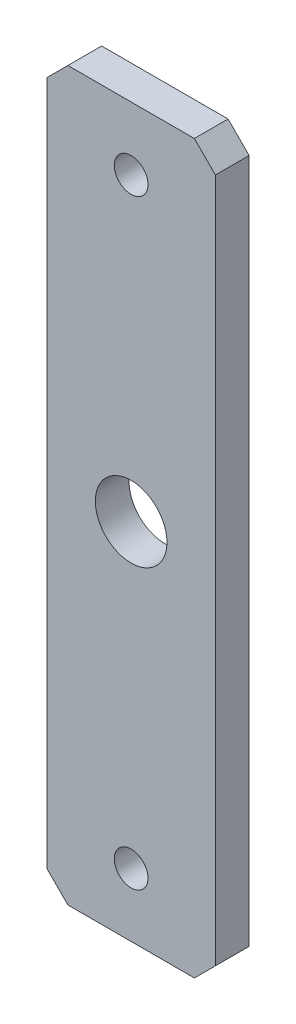
from build123d import *

# Parameters (mm, degrees)
SKETCH_1_W                  = 80
SKETCH_1_H                  = 345
EXTRUDE_1_DEPTH             = 16
HOLE_WIZARD_16_0_16_1_D     = 16
HOLE_WIZARD_16_0_16_1_DEPTH = 38
HOLE_WIZARD_16_0_16_1_TIP   = 4.806884952
CHAMFER_1_SIZE              = 10
HOLE_WIZARD_16_0_16_2_D     = 34


with BuildPart() as part:
    # 草图1 → 凸台-拉伸1 (new body)
    with BuildSketch(Plane.XY):
        with Locations((40, 172.5)):
            Rectangle(SKETCH_1_W, SKETCH_1_H)
    extrude(amount=EXTRUDE_1_DEPTH)

    # Ø16.0 (16) 直径孔1
    with Locations(Plane.XY.offset(16)):
        with Locations((40, 315), (40, 30)):
            Hole(HOLE_WIZARD_16_0_16_1_D / 2, depth=HOLE_WIZARD_16_0_16_1_DEPTH)
            with Locations((0, 0, -(HOLE_WIZARD_16_0_16_1_DEPTH + HOLE_WIZARD_16_0_16_1_TIP / 2))):  # 118° drill point
                Cone(0, HOLE_WIZARD_16_0_16_1_D / 2, HOLE_WIZARD_16_0_16_1_TIP, mode=Mode.SUBTRACT)

    # 倒角1
    chamfer_1_edges = [part.edges().sort_by_distance(p)[0] for p in [
        (0, 345, 8),
        (80, 345, 8),
        (80, 0, 8),
        (0, 0, 8),
    ]]
    chamfer(chamfer_1_edges, length=CHAMFER_1_SIZE)

    # Ø16.0 (16) 直径孔2 (through all)
    with Locations(Plane.XY.offset(16)):
        with Locations((40, 172.5)):
            Hole(HOLE_WIZARD_16_0_16_2_D / 2)


solid = part.part
